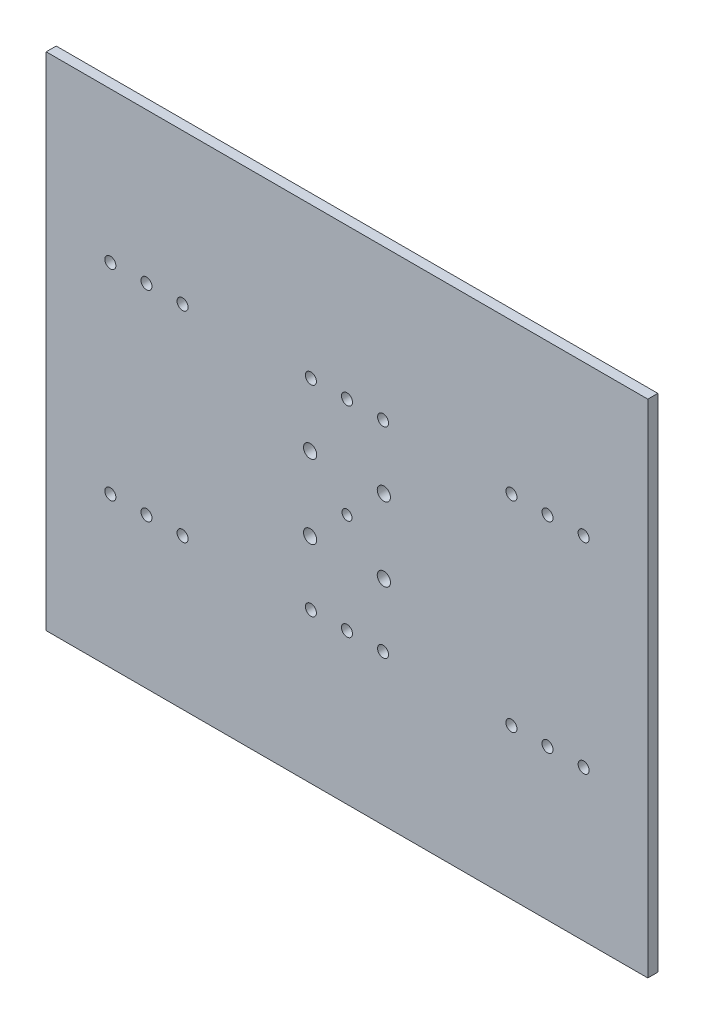
from build123d import *

# Parameters (mm, degrees)
SKETCH_1_W          = 300
SKETCH_1_H          = 250
SKETCH_1_R          = 3.3
SKETCH_1_R_2        = 2.5
EXTRUDE_1_DEPTH     = 5
SKETCH_2_R          = 2.75
CUT_EXTRUDE_1_DEPTH = 196.320249846


with BuildPart() as part:
    # 草图1 → 凸台-拉伸1 (new body)
    with BuildSketch(Plane.XY):
        Rectangle(SKETCH_1_W, SKETCH_1_H)
        with Locations((-18.384776311, 18.384776311)):
            Circle(SKETCH_1_R, mode=Mode.SUBTRACT)
        with Locations(Location((18.384776311, 18.384776311, 0), (0, 0, 180))):
            Circle(SKETCH_1_R, mode=Mode.SUBTRACT)
        with Locations((18.384776311, -18.384776311)):
            Circle(SKETCH_1_R, mode=Mode.SUBTRACT)
        with Locations(Location((-18.384776311, -18.384776311, 0), (0, 0, 180))):
            Circle(SKETCH_1_R, mode=Mode.SUBTRACT)
        Circle(SKETCH_1_R_2, mode=Mode.SUBTRACT)
    extrude(amount=EXTRUDE_1_DEPTH)

    # 草图2 → 切除-拉伸1 (cut, through all)
    with BuildSketch(Plane.XY.offset(5)):
        with Locations((-100, 50)):
            Circle(SKETCH_2_R)
        with Locations((0, 50)):
            Circle(SKETCH_2_R)
        with Locations((100, 50)):
            Circle(SKETCH_2_R)
        with Locations((100, -50)):
            Circle(SKETCH_2_R)
        with Locations((0, -50)):
            Circle(SKETCH_2_R)
        with Locations((-100, -50)):
            Circle(SKETCH_2_R)
        with Locations((-118, 50)):
            Circle(SKETCH_2_R)
        with Locations(Location((-82, 50, 0), (0, 0, 180))):
            Circle(SKETCH_2_R)
        with Locations((-82, -50)):
            Circle(SKETCH_2_R)
        with Locations(Location((-118, -50, 0), (0, 0, 180))):
            Circle(SKETCH_2_R)
        with Locations((-18, 50)):
            Circle(SKETCH_2_R)
        with Locations(Location((-18, -50, 0), (0, 0, 180))):
            Circle(SKETCH_2_R)
        with Locations((118, -50)):
            Circle(SKETCH_2_R)
        with Locations(Location((82, -50, 0), (0, 0, 180))):
            Circle(SKETCH_2_R)
        with Locations((18, -50)):
            Circle(SKETCH_2_R)
        with Locations(Location((18, 50, 0), (0, 0, 180))):
            Circle(SKETCH_2_R)
        with Locations((82, 50)):
            Circle(SKETCH_2_R)
        with Locations(Location((118, 50, 0), (0, 0, 180))):
            Circle(SKETCH_2_R)
    extrude(amount=-CUT_EXTRUDE_1_DEPTH, mode=Mode.SUBTRACT)


solid = part.part
